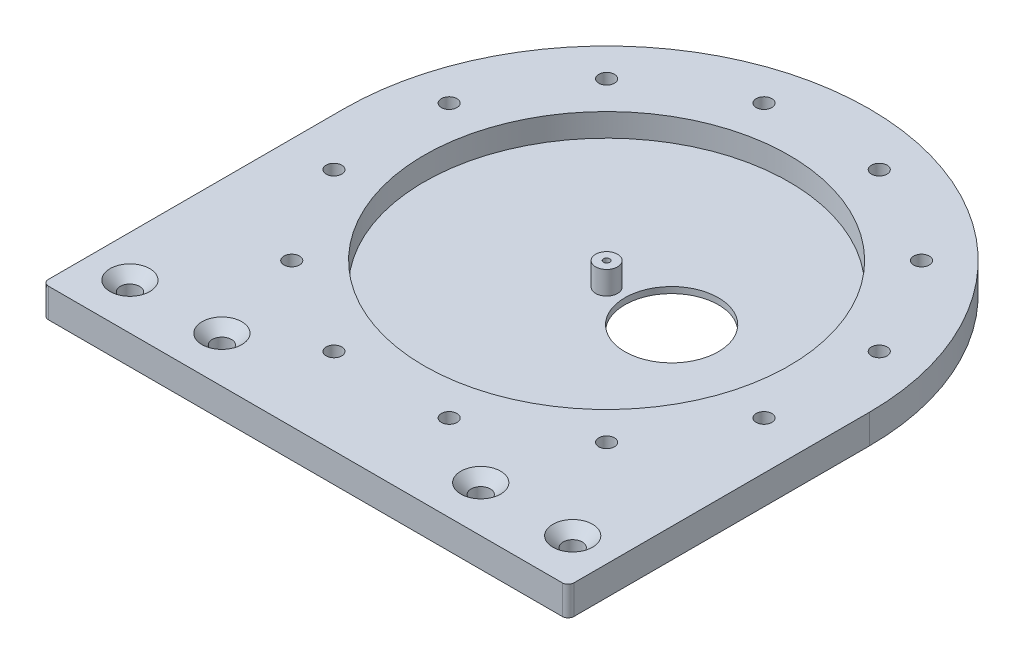
from build123d import *

# Parameters (mm, degrees)
SKETCH1_R                                       = 1.27
BOSS_EXTRUDE1_DEPTH                             = 12.7
SKETCH2_R                                       = 79.375
SKETCH2_R_2                                     = 4.7625
CUT_EXTRUDE1_DEPTH                              = 10.033
SKETCH4_R                                       = 0.127
CUT_EXTRUDE2_DEPTH                              = 175.348445656
M8X1_25_TAPPED_HOLE1_D                          = 6.8
FILLET1_R                                       = 2.54
CSK_FOR_M8_FLAT_HEAD_MACHINE_SCREW3_D           = 8.4
CSK_FOR_M8_FLAT_HEAD_MACHINE_SCREW3_CSINK_D     = 17.3
CSK_FOR_M8_FLAT_HEAD_MACHINE_SCREW3_CSINK_ANGLE = 90
SKETCH22_R                                      = 20.346771346
CUT_EXTRUDE3_DEPTH                              = 175.174486052
F_6_32_TAPPED_HOLE2_D                           = 2.7051


with BuildPart() as part:
    # Sketch1 → Boss-Extrude1 (new body)
    with BuildSketch(Plane(origin=(0, 0, 0), x_dir=(1, 0, 0), z_dir=(0, 1, 0))):
        with BuildLine():
            Line((-114.3, 0), (-114.3, -131.040453687))
            Line((-114.3, -131.040453687), (114.3, -131.040453687))
            Line((114.3, -131.040453687), (114.3, 0))
            ThreePointArc((114.3, 0), (0, 114.3), (-114.3, 0))
        make_face()
        with Locations(Location((-68.474452923, 68.474452923, 0), (0, 0, 270))):
            Circle(SKETCH1_R, mode=Mode.SUBTRACT)
        with Locations(Location((25.06338928, 93.537842203, 0), (0, 0, 270))):
            Circle(SKETCH1_R, mode=Mode.SUBTRACT)
        with Locations(Location((68.474452923, 68.474452923, 0), (0, 0, 270))):
            Circle(SKETCH1_R, mode=Mode.SUBTRACT)
        with Locations(Location((93.537842203, 25.06338928, 0), (0, 0, 270))):
            Circle(SKETCH1_R, mode=Mode.SUBTRACT)
        with Locations(Location((93.537842203, -25.06338928, 0), (0, 0, 270))):
            Circle(SKETCH1_R, mode=Mode.SUBTRACT)
        with Locations(Location((68.474452923, -68.474452923, 0), (0, 0, 270))):
            Circle(SKETCH1_R, mode=Mode.SUBTRACT)
        with Locations(Location((25.06338928, -93.537842203, 0), (0, 0, 270))):
            Circle(SKETCH1_R, mode=Mode.SUBTRACT)
        with Locations(Location((-25.06338928, -93.537842203, 0), (0, 0, 270))):
            Circle(SKETCH1_R, mode=Mode.SUBTRACT)
        with Locations(Location((-68.474452923, -68.474452923, 0), (0, 0, 270))):
            Circle(SKETCH1_R, mode=Mode.SUBTRACT)
        with Locations(Location((-93.537842203, -25.06338928, 0), (0, 0, 270))):
            Circle(SKETCH1_R, mode=Mode.SUBTRACT)
        with Locations(Location((-93.537842203, 25.06338928, 0), (0, 0, 270))):
            Circle(SKETCH1_R, mode=Mode.SUBTRACT)
        with Locations(Location((-25.06338928, 93.537842203, 0), (0, 0, 270))):
            Circle(SKETCH1_R, mode=Mode.SUBTRACT)
        with Locations(Location((96.3, -111.040453687, 0), (0, 0, 270))):
            Circle(SKETCH1_R, mode=Mode.SUBTRACT)
        with Locations(Location((56.3, -111.040453687, 0), (0, 0, 270))):
            Circle(SKETCH1_R, mode=Mode.SUBTRACT)
        with Locations(Location((-56.3, -111.040453687, 0), (0, 0, 270))):
            Circle(SKETCH1_R, mode=Mode.SUBTRACT)
        with Locations(Location((-96.3, -111.040453687, 0), (0, 0, 270))):
            Circle(SKETCH1_R, mode=Mode.SUBTRACT)
    extrude(amount=BOSS_EXTRUDE1_DEPTH)

    # Sketch2 → Cut-Extrude1 (cut)
    with BuildSketch(Plane(origin=(0, 12.7, 0), x_dir=(1, 0, 0), z_dir=(0, 1, 0))):
        with Locations(Location((0, 0, 0), (0, 0, 270))):
            Circle(SKETCH2_R)
        with Locations(Location((0, 0, 0), (0, 0, 270))):
            Circle(SKETCH2_R_2, mode=Mode.SUBTRACT)
    extrude(amount=-CUT_EXTRUDE1_DEPTH, mode=Mode.SUBTRACT)

    # Sketch4 → Cut-Extrude2 (cut, through all)
    with BuildSketch(Plane(origin=(0, 12.7, 0), x_dir=(1, 0, 0), z_dir=(0, 1, 0))):
        with Locations(Location((0, 0, 0), (0, 0, 270))):
            Circle(SKETCH4_R)
    extrude(amount=-CUT_EXTRUDE2_DEPTH, mode=Mode.SUBTRACT)

    # M8x1.25 Tapped Hole1 (through all)
    with Locations(Plane(origin=(0, 12.7, 0), x_dir=(1, 0, 0), z_dir=(0, 1, 0))):
        with Locations((-93.537842203, 25.06338928), (-93.537842203, -25.06338928), (-25.06338928, 93.537842203), (-68.474452923, 68.474452923), (25.06338928, 93.537842203), (68.474452923, 68.474452923), (93.537842203, 25.06338928), (93.537842203, -25.06338928), (68.474452923, -68.474452923), (25.06338928, -93.537842203), (-25.06338928, -93.537842203), (-68.474452923, -68.474452923)):
            Hole(M8X1_25_TAPPED_HOLE1_D / 2)

    # Fillet1
    fillet1_edges = [part.edges().sort_by_distance(p)[0] for p in [
        (114.3, 6.35, 131.040453687),
        (-114.3, 6.35, 131.040453687),
    ]]
    fillet(fillet1_edges, radius=FILLET1_R)

    # CSK for M8 Flat Head Machine Screw3 (through all)
    with Locations(Plane(origin=(0, 12.7, 0), x_dir=(1, 0, 0), z_dir=(0, 1, 0))):
        with Locations((-96.3, -111.040453687), (-56.3, -111.040453687), (56.3, -111.040453687), (96.3, -111.040453687)):
            CounterSinkHole(CSK_FOR_M8_FLAT_HEAD_MACHINE_SCREW3_D / 2, CSK_FOR_M8_FLAT_HEAD_MACHINE_SCREW3_CSINK_D / 2, counter_sink_angle=CSK_FOR_M8_FLAT_HEAD_MACHINE_SCREW3_CSINK_ANGLE)

    # Sketch22 → Cut-Extrude3 (cut, through all)
    with BuildSketch(Plane(origin=(0, 2.667, 0), x_dir=(1, 0, 0), z_dir=(0, 1, 0))):
        with Locations(Location((28.284271346, 0, 0), (0, 0, 270))):
            Circle(SKETCH22_R)
    extrude(amount=-CUT_EXTRUDE3_DEPTH, mode=Mode.SUBTRACT)

    # #6-32 Tapped Hole2 (through all)
    with Locations(Plane(origin=(0, 12.7, 0), x_dir=(1, 0, 0), z_dir=(0, 1, 0))):
        with Locations((0, 0)):
            Hole(F_6_32_TAPPED_HOLE2_D / 2)


solid = part.part
